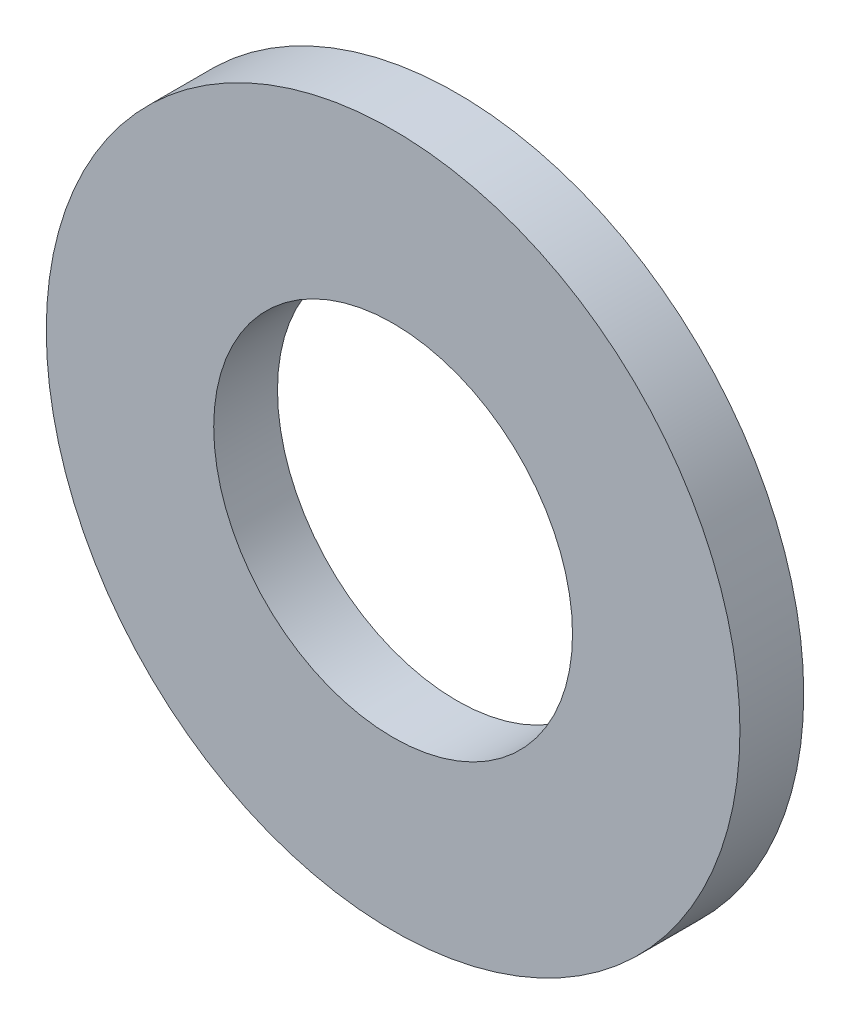
from build123d import *

# Parameters (mm, degrees)
SKETCH1_R           = 4.35
SKETCH1_R_2         = 2.25
BOSS_EXTRUDE1_DEPTH = 0.8


with BuildPart() as part:
    # Sketch1 → Boss-Extrude1 (new body)
    with BuildSketch(Plane.XY):
        Circle(SKETCH1_R)
        Circle(SKETCH1_R_2, mode=Mode.SUBTRACT)
    extrude(amount=BOSS_EXTRUDE1_DEPTH)


solid = part.part
